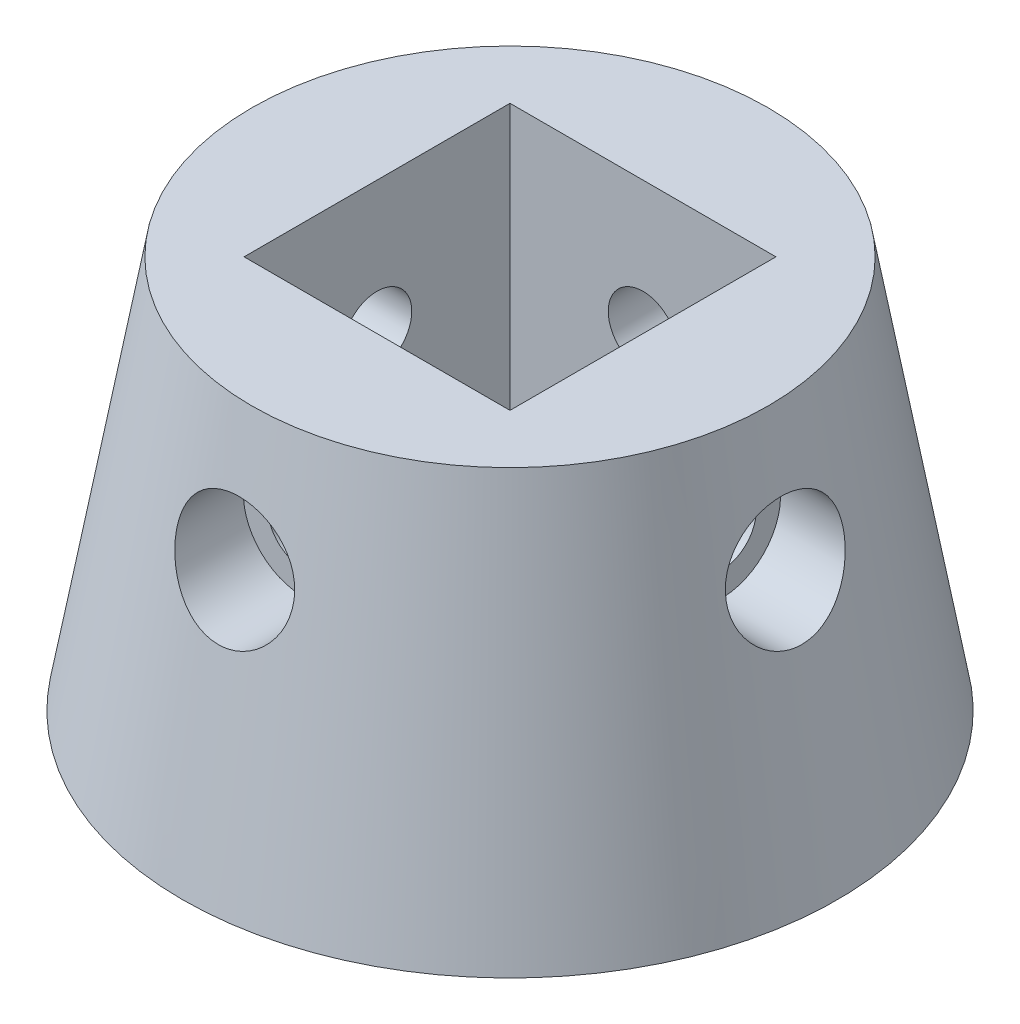
from build123d import *

# Parameters (mm, degrees)
SKETCH_1_R               = 25
EXTRUDE_1_DEPTH          = 30
EXTRUDE_1_TAPER          = 10
SKETCH_3_W               = 20.3
SKETCH_3_H               = 20.3
CUT_EXTRUDE_2_DEPTH      = 47.36809265
CUT_EXTRUDE_3_DEPTH      = 53.540674891
CUT_EXTRUDE_3_DEPTH_BACK = 53.540674891
SKETCH_4_R               = 2.65
CUT_EXTRUDE_4_DEPTH      = 53.540674891
CUT_EXTRUDE_4_DEPTH_BACK = 53.540674891
SKETCH_5_R               = 2.65
CUT_EXTRUDE_START        = -15
SKETCH_6_R               = 4.5
CUT_EXTRUDE_5_DEPTH      = 19
SKETCH_7_R               = 4.5
CUT_EXTRUDE_6_DEPTH      = 19


with BuildPart() as part:
    # 草图1 → 凸台-拉伸1 (new body)
    with BuildSketch(Plane(origin=(0, 0, 0), x_dir=(1, 0, 0), z_dir=(0, 1, 0))):
        Circle(SKETCH_1_R)
    extrude(amount=EXTRUDE_1_DEPTH, taper=EXTRUDE_1_TAPER)

    # 草图3 → 切除-拉伸2 (cut, through all)
    with BuildSketch(Plane(origin=(0, 30, 0), x_dir=(1, 0, 0), z_dir=(0, 1, 0))):
        Rectangle(SKETCH_3_W, SKETCH_3_H)
    extrude(amount=-CUT_EXTRUDE_2_DEPTH, mode=Mode.SUBTRACT)

    # 草图4 → 切除-拉伸3 (cut, two sides: drawn at the far end of the back side and taken through both)
    with BuildSketch(Plane(origin=(-10.15, 0, 0), x_dir=(0, 0, -1), z_dir=(1, 0, 0)).offset(-CUT_EXTRUDE_3_DEPTH_BACK)):
        with Locations(Location((0, 20, 0), (0, 0, 301.069984195))):
            Circle(SKETCH_4_R)
    extrude(amount=CUT_EXTRUDE_3_DEPTH + CUT_EXTRUDE_3_DEPTH_BACK, mode=Mode.SUBTRACT)

    # 草图5 → 切除-拉伸4 (cut, two sides: drawn at the far end of the back side and taken through both)
    with BuildSketch(Plane(origin=(0, 0, 10.15), x_dir=(-1, 0, 0), z_dir=(0, 0, -1)).offset(-CUT_EXTRUDE_4_DEPTH_BACK)):
        with Locations((0, 20)):
            Circle(SKETCH_5_R)
    extrude(amount=CUT_EXTRUDE_4_DEPTH + CUT_EXTRUDE_4_DEPTH_BACK, mode=Mode.SUBTRACT)

    # 草图6 → 切除-拉伸5 (cut)
    with BuildSketch(Plane.XY.offset(-20.15).offset(CUT_EXTRUDE_START)):
        with Locations(Location((0, 20, 0), (0, 0, 224.651479051))):
            Circle(SKETCH_6_R)
    cut_extrude_5 = extrude(amount=CUT_EXTRUDE_5_DEPTH, mode=Mode.SUBTRACT)

    # 草图7 → 切除-拉伸6 (cut)
    with BuildSketch(Plane.ZY.offset(-20.15).offset(CUT_EXTRUDE_START)):
        with Locations(Location((0, 20, 0), (0, 0, 224.651479051))):
            Circle(SKETCH_7_R)
    cut_extrude_6 = extrude(amount=CUT_EXTRUDE_6_DEPTH, mode=Mode.SUBTRACT)

    # 镜向1: 切除-拉伸6 across plane
    add(cut_extrude_6.mirror(Plane.ZY.offset(-0.15)), mode=Mode.SUBTRACT)

    # 镜向2: 切除-拉伸5 across plane
    add(cut_extrude_5.mirror(Plane.XY.offset(-0.15)), mode=Mode.SUBTRACT)


solid = part.part
